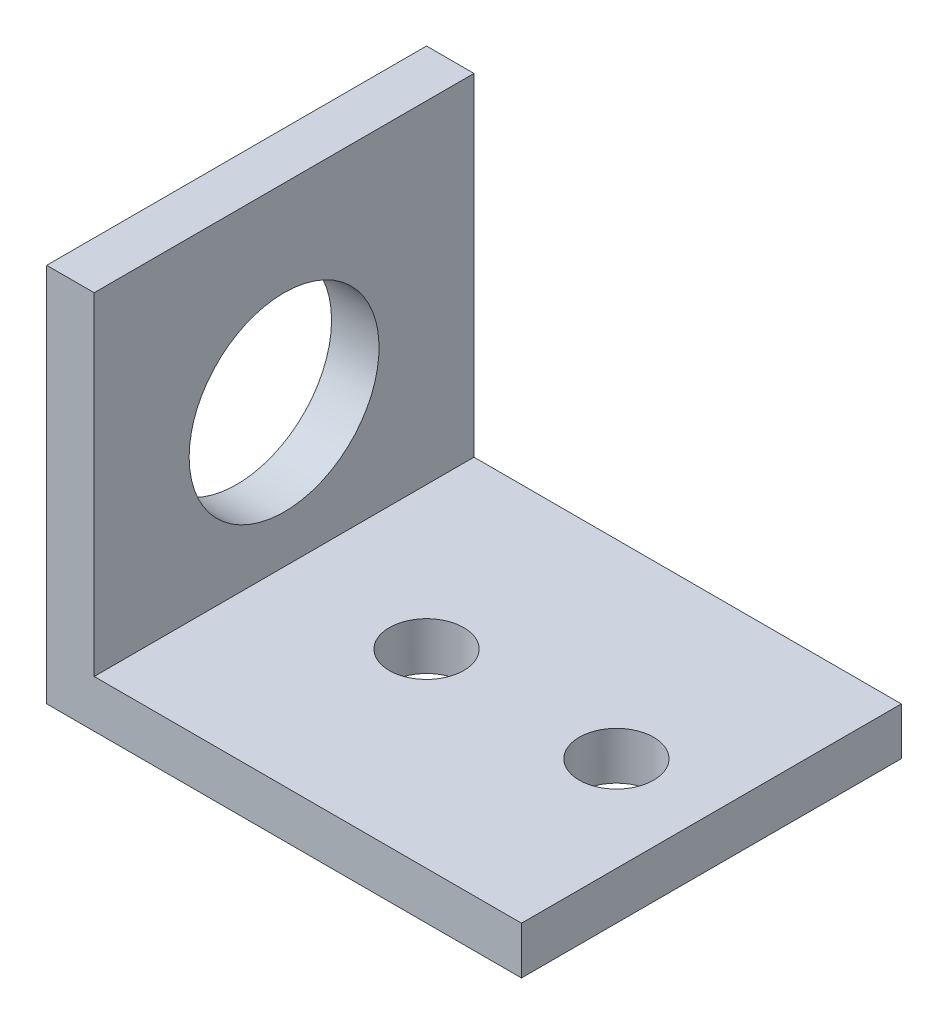
from build123d import *

# Parameters (mm, degrees)
BOSS_EXTRUDE1_DEPTH = 25.4
SKETCH3_R           = 6.35
CUT_EXTRUDE1_DEPTH  = 48.941448664
SKETCH2_R           = 2.4892
CUT_EXTRUDE2_DEPTH  = 48.941448664


with BuildPart() as part:
    # Sketch1 → Boss-Extrude1 (new body)
    with BuildSketch(Plane.XY):
        Polygon((0, 0), (0, 25.4), (3.175, 25.4), (3.175, 3.175), (31.75, 3.175), (31.75, 0), align=None)
    extrude(amount=BOSS_EXTRUDE1_DEPTH)

    # Sketch3 → Cut-Extrude1 (cut, through all)
    with BuildSketch(Plane.ZY):
        with Locations((12.7, 12.7)):
            Circle(SKETCH3_R)
    extrude(amount=-CUT_EXTRUDE1_DEPTH, mode=Mode.SUBTRACT)

    # Sketch2 → Cut-Extrude2 (cut, through all)
    with BuildSketch(Plane.XZ):
        with Locations((12.7, 12.7)):
            Circle(SKETCH2_R)
        with Locations((25.4, 12.7)):
            Circle(SKETCH2_R)
    extrude(amount=-CUT_EXTRUDE2_DEPTH, mode=Mode.SUBTRACT)


solid = part.part
